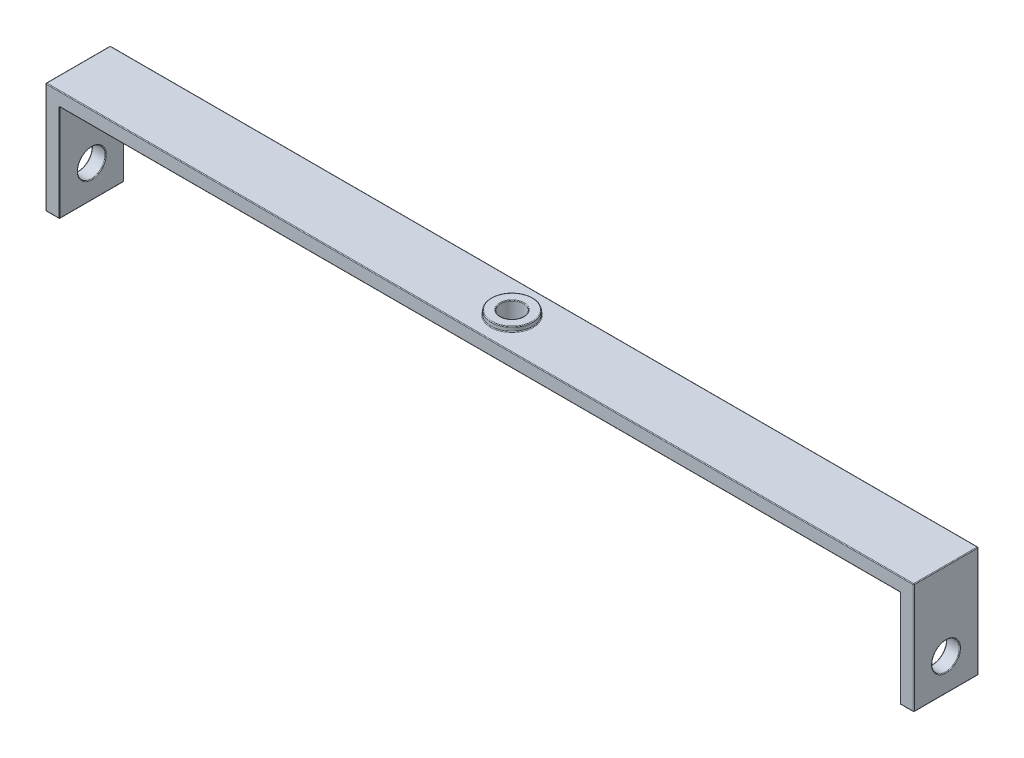
from build123d import *

# Parameters (mm, degrees)
BOSS_EXTRUDE1_DEPTH      = 3.5
BOSS_EXTRUDE1_DEPTH_BACK = 3.5
CUT_EXTRUDE1_DEPTH       = 49.633835958
CUT_EXTRUDE1_DEPTH_BACK  = 49.633835958
SKETCH2_R                = 1.25
BOSS_EXTRUDE2_START      = 0.5
SKETCH3_R                = 2.25
SKETCH3_R_2              = 1.25
BOSS_EXTRUDE2_DEPTH      = 0.5
CUT_EXTRUDE2_DEPTH       = 49.633835958
CUT_EXTRUDE2_DEPTH_BACK  = 49.633835958
SKETCH4_R                = 1.5
FILLET1_R                = 0.075


with BuildPart() as part:
    # Sketch1 → Boss-Extrude1 (new, two sides: drawn at the far end of the back side and taken through both)
    with BuildSketch(Plane.XY.offset(-BOSS_EXTRUDE1_DEPTH_BACK)):
        Polygon((-47, 0), (47, 0), (47, -12), (45.5, -12), (45.5, -1.5), (-45.5, -1.5), (-45.5, -12), (-47, -12), align=None)
    extrude(amount=BOSS_EXTRUDE1_DEPTH + BOSS_EXTRUDE1_DEPTH_BACK)

    # Sketch2 → Cut-Extrude1 (cut, two sides: drawn at the far end of the back side and taken through both)
    with BuildSketch(Plane(origin=(0, 0, 0), x_dir=(1, 0, 0), z_dir=(0, 1, 0)).offset(-CUT_EXTRUDE1_DEPTH_BACK)):
        Circle(SKETCH2_R)
    extrude(amount=CUT_EXTRUDE1_DEPTH + CUT_EXTRUDE1_DEPTH_BACK, mode=Mode.SUBTRACT)

    # Sketch3 → Boss-Extrude2 (add)
    with BuildSketch(Plane(origin=(0, 0, 0), x_dir=(1, 0, 0), z_dir=(0, 1, 0)).offset(BOSS_EXTRUDE2_START)):
        Circle(SKETCH3_R)
        Circle(SKETCH3_R_2, mode=Mode.SUBTRACT)
    extrude(amount=-BOSS_EXTRUDE2_DEPTH)

    # Sketch4 → Cut-Extrude2 (cut, two sides: drawn at the far end of the back side and taken through both)
    with BuildSketch(Plane(origin=(0, 0, 0), x_dir=(0, 0, -1), z_dir=(1, 0, 0)).offset(-CUT_EXTRUDE2_DEPTH_BACK)):
        with Locations((0, -8.5)):
            Circle(SKETCH4_R)
    extrude(amount=CUT_EXTRUDE2_DEPTH + CUT_EXTRUDE2_DEPTH_BACK, mode=Mode.SUBTRACT)

    # Fillet1
    fillet1_edges = [part.edges().sort_by_distance(p)[0] for p in [
        (47, -8.5, 1.5),
        (-47, -8.5, 1.5),
        (-45.5, -8.5, 1.5),
        (45.5, -8.5, 1.5),
        (-2.25, 0, 0),
        (-1.25, 0.5, 0),
        (-2.25, 0.5, 0),
        (-1.25, -1.5, 0),
        (-47, -6, 3.5),
        (-46.25, -12, 3.5),
        (-45.5, -6.75, 3.5),
        (0, -1.5, 3.5),
        (45.5, -6.75, 3.5),
        (46.25, -12, 3.5),
        (47, -6, 3.5),
        (-47, -6, -3.5),
        (-46.25, -12, -3.5),
        (-45.5, -6.75, -3.5),
        (0, -1.5, -3.5),
        (45.5, -6.75, -3.5),
        (46.25, -12, -3.5),
        (47, -6, -3.5),
        (0, 0, -3.5),
        (-47, -12, 0),
        (-45.5, -12, 0),
        (-45.5, -1.5, 0),
        (45.5, -1.5, 0),
        (45.5, -12, 0),
        (47, -12, 0),
        (47, 0, 0),
        (-47, 0, 0),
        (0, 0, 3.5),
    ]]
    fillet(fillet1_edges, radius=FILLET1_R)


solid = part.part
